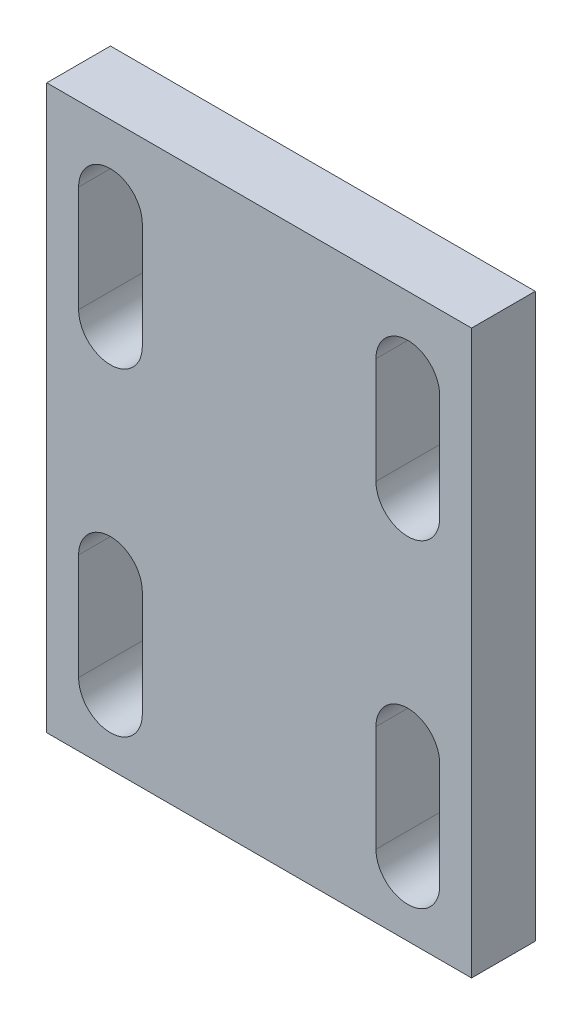
from build123d import *

# Parameters (mm, degrees)
SKETCH1_W           = 20
SKETCH1_H           = 26.5
BOSS_EXTRUDE1_DEPTH = 3


with BuildPart() as part:
    # Sketch1 → Boss-Extrude1 (new body)
    with BuildSketch(Plane.XY):
        with Locations((10, 13.25)):
            Rectangle(SKETCH1_W, SKETCH1_H)
        with BuildLine():
            Line((4.5, 8), (4.5, 3))
            ThreePointArc((4.5, 3), (3, 1.5), (1.5, 3))
            Line((1.5, 3), (1.5, 8))
            ThreePointArc((1.5, 8), (3, 9.5), (4.5, 8))
        make_face(mode=Mode.SUBTRACT)
        with BuildLine():
            Line((18.5, 8), (18.5, 3))
            ThreePointArc((18.5, 3), (17, 1.5), (15.5, 3))
            Line((15.5, 3), (15.5, 8))
            ThreePointArc((15.5, 8), (17, 9.5), (18.5, 8))
        make_face(mode=Mode.SUBTRACT)
        with BuildLine():
            Line((18.5, 23), (18.5, 18))
            ThreePointArc((18.5, 18), (17, 16.5), (15.5, 18))
            Line((15.5, 18), (15.5, 23))
            ThreePointArc((15.5, 23), (17, 24.5), (18.5, 23))
        make_face(mode=Mode.SUBTRACT)
        with BuildLine():
            Line((4.5, 23), (4.5, 18))
            ThreePointArc((4.5, 18), (3, 16.5), (1.5, 18))
            Line((1.5, 18), (1.5, 23))
            ThreePointArc((1.5, 23), (3, 24.5), (4.5, 23))
        make_face(mode=Mode.SUBTRACT)
    extrude(amount=BOSS_EXTRUDE1_DEPTH)


solid = part.part
